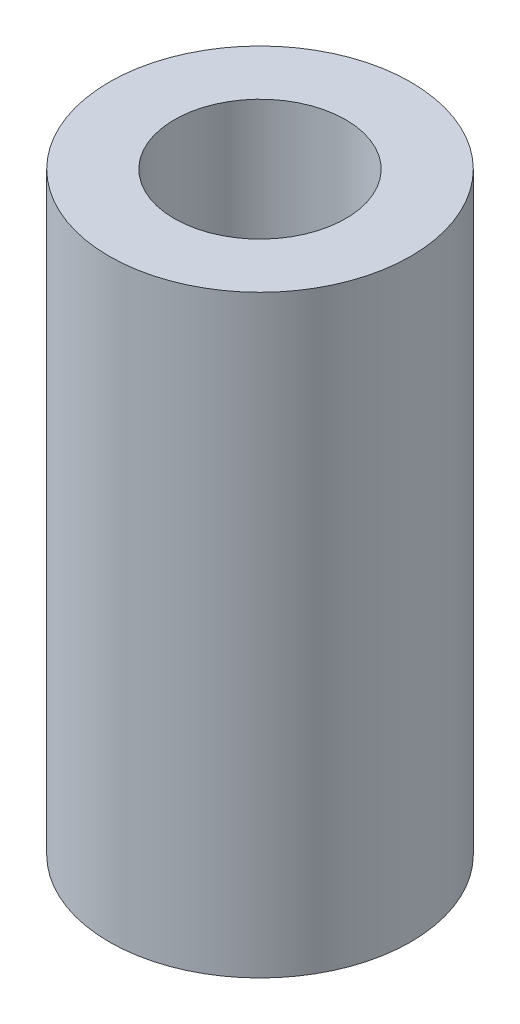
from build123d import *

# Parameters (mm, degrees)
SKETCH2_R           = 2.794
SKETCH2_R_2         = 1.5875
BOSS_EXTRUDE1_DEPTH = 11
FILLET1_R           = 0.5953125


with BuildPart() as part:
    # Sketch2 → Boss-Extrude1 (new body)
    with BuildSketch(Plane(origin=(0, 0, 0), x_dir=(1, 0, 0), z_dir=(0, 1, 0))):
        with Locations(Location((0, 0, 0), (0, 0, 270))):
            Circle(SKETCH2_R)
        with Locations(Location((0, 0, 0), (0, 0, 270))):
            Circle(SKETCH2_R_2, mode=Mode.SUBTRACT)
    extrude(amount=BOSS_EXTRUDE1_DEPTH)

    # Fillet1
    fillet1_edges = [part.edges().sort_by_distance(p)[0] for p in [
        (0, 0, -1.5875),
    ]]
    fillet(fillet1_edges, radius=FILLET1_R)


solid = part.part
